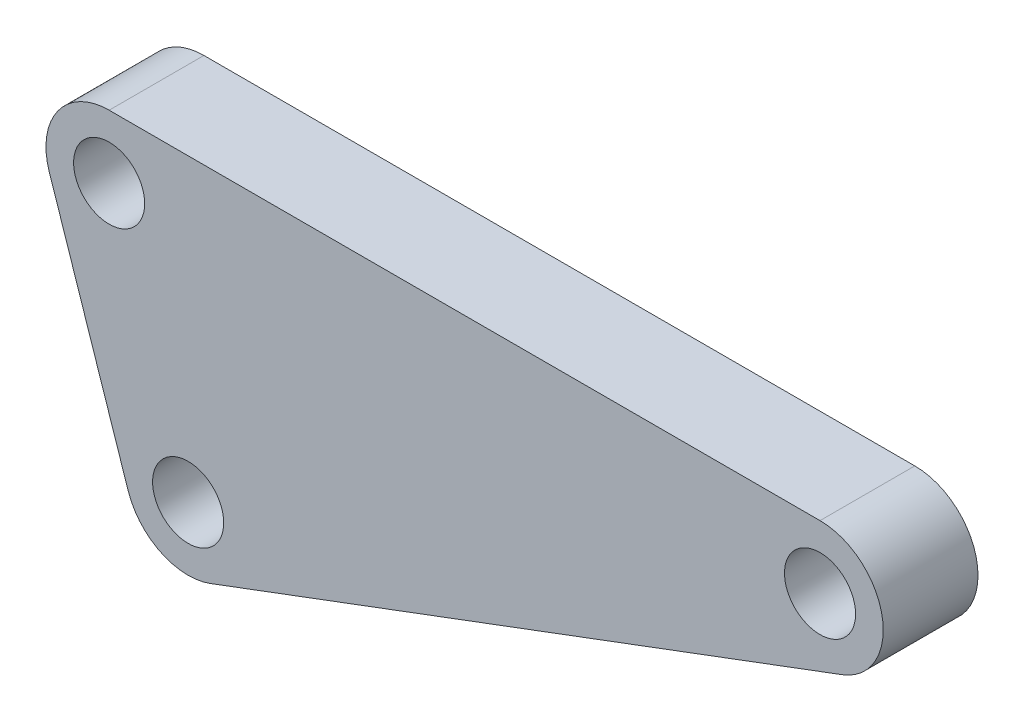
from build123d import *

# Parameters (mm, degrees)
SKETCH1_R           = 2.25
BOSS_EXTRUDE1_DEPTH = 6


with BuildPart() as part:
    # Sketch1 → Boss-Extrude1 (new body)
    with BuildSketch(Plane.XY):
        with BuildLine():
            Line((-5, 19), (40, 19))
            ThreePointArc((40, 19), (43.9358142, 15.713699222), (41.404493766, 11.25468329))
            Line((41.404493766, 11.25468329), (1.404493766, -3.74531671))
            ThreePointArc((1.404493766, -3.74531671), (-1.722328125, -3.610205788), (-3.794733192, -1.264911064))
            Line((-3.794733192, -1.264911064), (-8.794733192, 13.735088936))
            ThreePointArc((-8.794733192, 13.735088936), (-8.244968741, 17.338841139), (-5, 19))
        make_face()
        Circle(SKETCH1_R, mode=Mode.SUBTRACT)
        with Locations((-5, 15)):
            Circle(SKETCH1_R, mode=Mode.SUBTRACT)
        with Locations((40, 15)):
            Circle(SKETCH1_R, mode=Mode.SUBTRACT)
    extrude(amount=BOSS_EXTRUDE1_DEPTH)


solid = part.part
